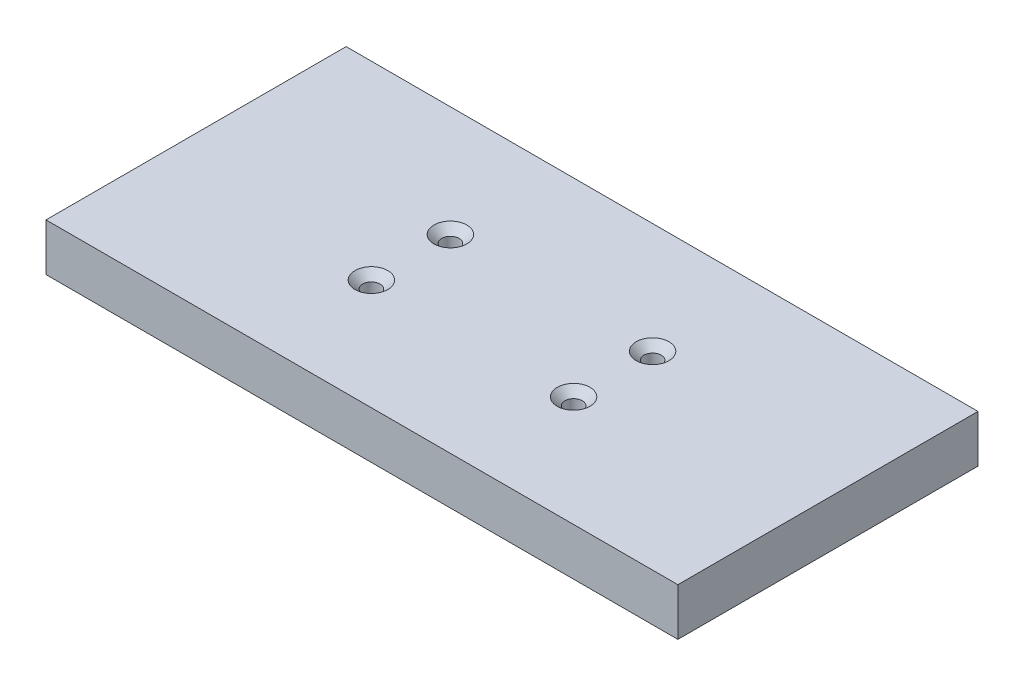
from build123d import *

# Parameters (mm, degrees)
SKETCH1_W                                            = 200
SKETCH1_H                                            = 95
BOSS_EXTRUDE1_DEPTH                                  = 15
CSK_FOR_M5_CROSS_RECESS_FLAT_HEAD_SCREW2_D           = 5.5
CSK_FOR_M5_CROSS_RECESS_FLAT_HEAD_SCREW2_CSINK_D     = 10.4
CSK_FOR_M5_CROSS_RECESS_FLAT_HEAD_SCREW2_CSINK_ANGLE = 90


with BuildPart() as part:
    # Sketch1 → Boss-Extrude1 (new body)
    with BuildSketch(Plane(origin=(0, 0, 0), x_dir=(1, 0, 0), z_dir=(0, 1, 0))):
        Rectangle(SKETCH1_W, SKETCH1_H)
    extrude(amount=BOSS_EXTRUDE1_DEPTH)

    # CSK for M5 Cross Recess Flat Head Screw2 (through all)
    with Locations(Plane(origin=(0, 15, 0), x_dir=(1, 0, 0), z_dir=(0, 1, 0))):
        with Locations((32, 12.5), (32, -12.5), (-32, -12.5), (-32, 12.5)):
            CounterSinkHole(CSK_FOR_M5_CROSS_RECESS_FLAT_HEAD_SCREW2_D / 2, CSK_FOR_M5_CROSS_RECESS_FLAT_HEAD_SCREW2_CSINK_D / 2, counter_sink_angle=CSK_FOR_M5_CROSS_RECESS_FLAT_HEAD_SCREW2_CSINK_ANGLE)


solid = part.part
